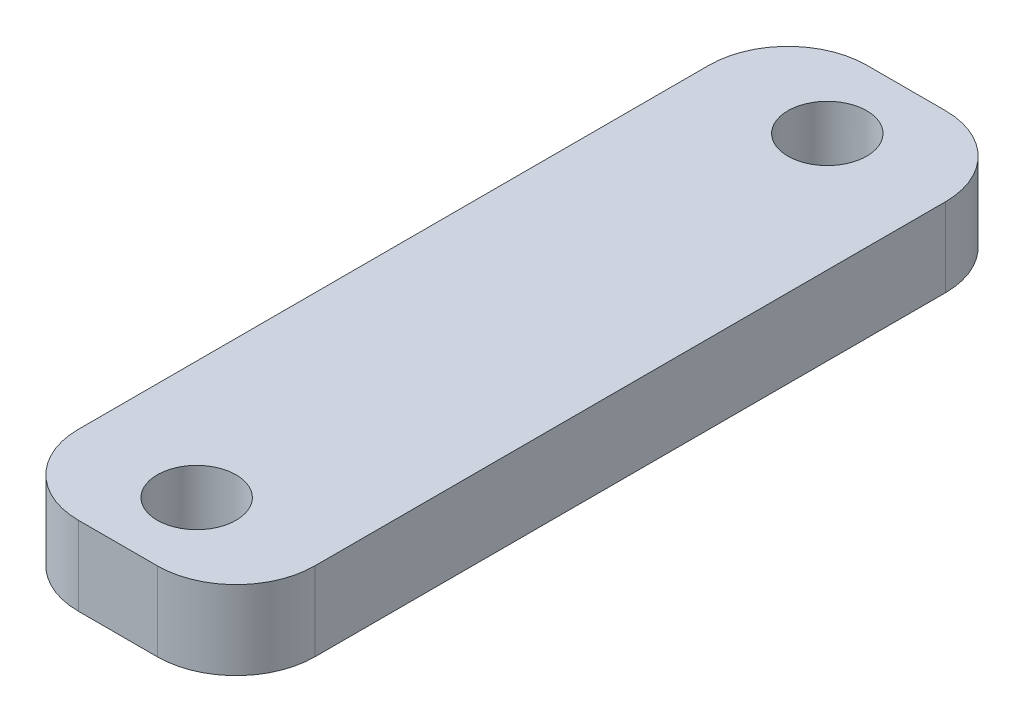
from build123d import *

# Parameters (mm, degrees)
SKETCH1_W           = 30
SKETCH1_H           = 100
BOSS_EXTRUDE1_DEPTH = 10
SKETCH2_R           = 5
CUT_EXTRUDE1_DEPTH  = 10
FILLET1_R           = 10
FILLET2_R           = 10


with BuildPart() as part:
    # Sketch1 → Boss-Extrude1 (new body)
    with BuildSketch(Plane(origin=(0, 0, 0), x_dir=(1, 0, 0), z_dir=(0, 1, 0))):
        Rectangle(SKETCH1_W, SKETCH1_H)
    extrude(amount=BOSS_EXTRUDE1_DEPTH)

    # Sketch2 → Cut-Extrude1 (cut)
    with BuildSketch(Plane(origin=(0, 10, 0), x_dir=(1, 0, 0), z_dir=(0, 1, 0))):
        with Locations(Location((0, 40, 0), (0, 0, 270))):
            Circle(SKETCH2_R)
        with Locations(Location((0, -40, 0), (0, 0, 270))):
            Circle(SKETCH2_R)
    extrude(amount=-CUT_EXTRUDE1_DEPTH, mode=Mode.SUBTRACT)

    # Fillet1
    fillet1_edges = [part.edges().sort_by_distance(p)[0] for p in [
        (15, 5, 50),
        (-15, 5, 50),
    ]]
    fillet(fillet1_edges, radius=FILLET1_R)

    # Fillet2
    fillet2_edges = [part.edges().sort_by_distance(p)[0] for p in [
        (-15, 5, -50),
        (15, 5, -50),
    ]]
    fillet(fillet2_edges, radius=FILLET2_R)


solid = part.part
